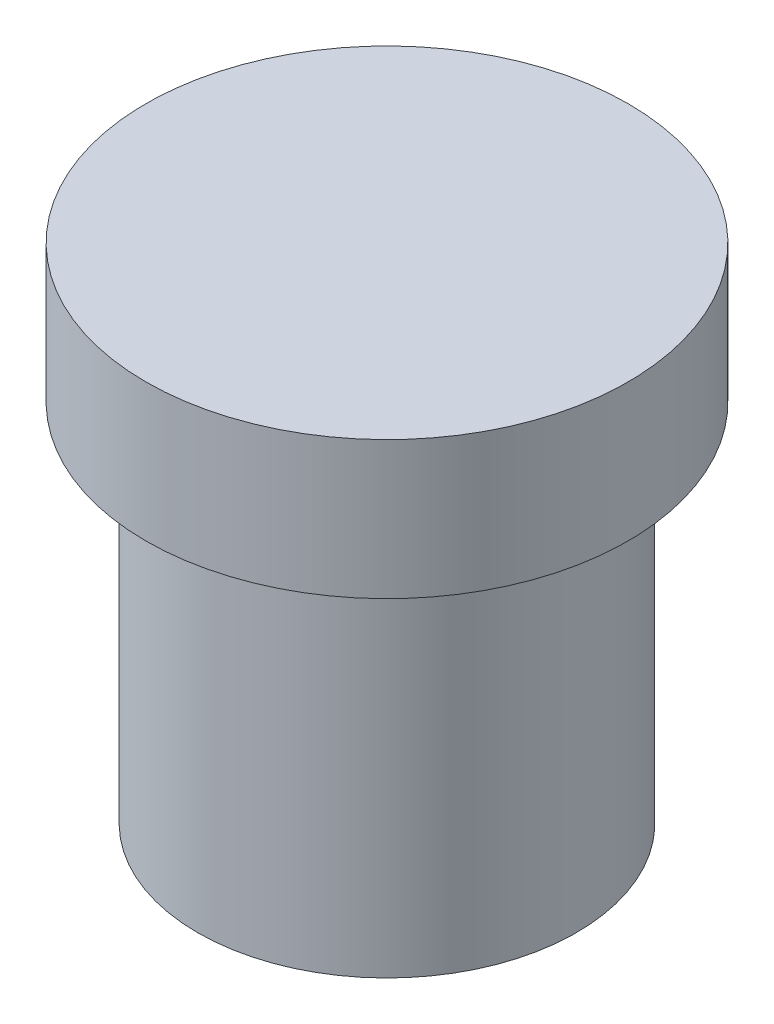
from build123d import *

# Parameters (mm, degrees)
SKETCH1_R           = 5
BOSS_EXTRUDE1_DEPTH = 10
SKETCH2_R           = 27.5
BOSS_EXTRUDE2_DEPTH = 53
SKETCH3_R           = 35
BOSS_EXTRUDE3_DEPTH = 20


with BuildPart() as part:
    # Sketch1 → Boss-Extrude1 (new body)
    with BuildSketch(Plane(origin=(0, 0, 0), x_dir=(1, 0, 0), z_dir=(0, 1, 0))):
        with Locations(Location((0, 0, 0), (0, 0, 270))):
            Circle(SKETCH1_R)
    extrude(amount=BOSS_EXTRUDE1_DEPTH)

    # Sketch2 → Boss-Extrude2 (add)
    with BuildSketch(Plane(origin=(0, 10, 0), x_dir=(1, 0, 0), z_dir=(0, 1, 0))):
        with Locations(Location((0, 0, 0), (0, 0, 270))):
            Circle(SKETCH2_R)
    extrude(amount=BOSS_EXTRUDE2_DEPTH)

    # Sketch3 → Boss-Extrude3 (add)
    with BuildSketch(Plane(origin=(0, 63, 0), x_dir=(1, 0, 0), z_dir=(0, 1, 0))):
        with Locations(Location((0, 0, 0), (0, 0, 270))):
            Circle(SKETCH3_R)
    extrude(amount=BOSS_EXTRUDE3_DEPTH)


solid = part.part
